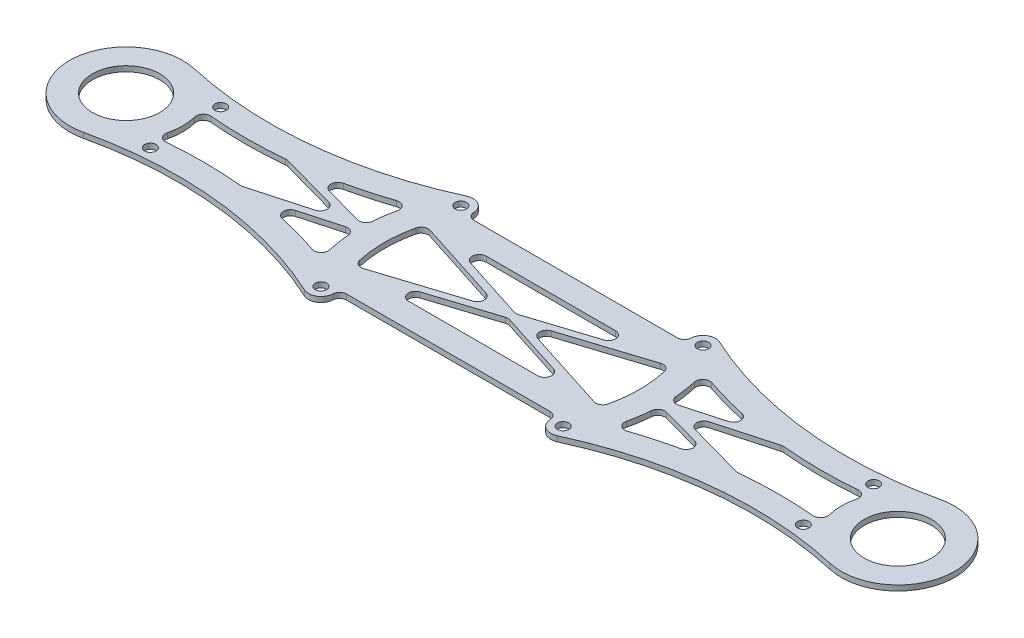
from build123d import *

# Parameters (mm, degrees)
SKETCH1_R                  = 3.5
BOSS_EXTRUDE1_DEPTH        = 0.75
F_3_2_3_2_DIAMETER_HOLE1_D = 3.2
SKETCH4_R                  = 9.5
CUT_EXTRUDE1_DEPTH         = 128.152713302
CUT_EXTRUDE4_DEPTH         = 128.152713302
FILLET1_R                  = 2


with BuildPart() as part:
    # Sketch1 → Boss-Extrude1 (new, symmetric)
    with BuildSketch(Plane(origin=(0, 0, 0), x_dir=(1, 0, 0), z_dir=(0, 1, 0))):
        with BuildLine():
            ThreePointArc((-37.239092363, -21.5), (-43, 0), (-37.239092363, 21.5))
            ThreePointArc((-37.239092363, 21.5), (-36.567343094, 22.335249783), (-35.674318722, 22.928037055))
            ThreePointArc((-35.674318722, 22.928037055), (-69.961373448, 13.496685886), (-105.45946442, 15.603352454))
            ThreePointArc((-105.45946442, 15.603352454), (-125, 0), (-105.45946442, -15.603352454))
            ThreePointArc((-105.45946442, -15.603352454), (-69.961373448, -13.496685886), (-35.674318722, -22.928037055))
            ThreePointArc((-35.674318722, -22.928037055), (-36.567343094, -22.335249783), (-37.239092363, -21.5))
        make_face()
        with BuildLine():
            ThreePointArc((-31.176914536, -18), (-36, 0), (-31.176914536, 18))
            ThreePointArc((-31.176914536, 18), (-35.958003449, 16.718911087), (-37.239092363, 21.5))
            ThreePointArc((-37.239092363, 21.5), (-43, 0), (-37.239092363, -21.5))
            ThreePointArc((-37.239092363, -21.5), (-35.958003449, -16.718911087), (-31.176914536, -18))
        make_face()
        with Locations((-34.208003449, -19.75)):
            Circle(SKETCH1_R)
        with Locations((-34.208003449, 19.75)):
            Circle(SKETCH1_R)
        with BuildLine():
            ThreePointArc((31.176914536, 18), (36, 0), (31.176914536, -18))
            Line((31.176914536, -18), (-31.176914536, -18))
            ThreePointArc((-31.176914536, -18), (-36, 0), (-31.176914536, 18))
            Line((-31.176914536, 18), (31.176914536, 18))
        make_face()
        with Locations((34.208003449, 19.75)):
            Circle(SKETCH1_R)
        with BuildLine():
            ThreePointArc((37.708003449, 19.75), (35.113870107, 16.369259608), (31.176914536, 18))
            ThreePointArc((31.176914536, 18), (36, 0), (31.176914536, -18))
            ThreePointArc((31.176914536, -18), (35.113870107, -16.369259608), (37.708003449, -19.75))
            ThreePointArc((37.708003449, -19.75), (37.588743841, -20.655866658), (37.239092363, -21.5))
            ThreePointArc((37.239092363, -21.5), (43, 0), (37.239092363, 21.5))
            ThreePointArc((37.239092363, 21.5), (37.588743841, 20.655866658), (37.708003449, 19.75))
        make_face()
        with Locations((34.208003449, -19.75)):
            Circle(SKETCH1_R)
        with BuildLine():
            ThreePointArc((105.45946442, 15.603352454), (69.961373448, 13.496685886), (35.674318722, 22.928037055))
            ThreePointArc((35.674318722, 22.928037055), (36.567343094, 22.335249783), (37.239092363, 21.5))
            ThreePointArc((37.239092363, 21.5), (43, 0), (37.239092363, -21.5))
            ThreePointArc((37.239092363, -21.5), (36.567343094, -22.335249783), (35.674318722, -22.928037055))
            ThreePointArc((35.674318722, -22.928037055), (69.961373448, -13.496685886), (105.45946442, -15.603352454))
            ThreePointArc((105.45946442, -15.603352454), (125, 0), (105.45946442, 15.603352454))
        make_face()
    extrude(amount=BOSS_EXTRUDE1_DEPTH, both=True)

    # Ø3.2 (3.2) Diameter Hole1 (through all)
    with Locations(Plane(origin=(0, 0.75, 0), x_dir=(1, 0, 0), z_dir=(0, 1, 0))):
        with Locations((-34.208003449, 19.75), (-34.208003449, -19.75), (34.208003449, -19.75), (34.208003449, 19.75), (-92.21668251, 9.928255337), (-92.21668251, -9.928255337), (92.21668251, 9.928255337), (92.21668251, -9.928255337)):
            Hole(F_3_2_3_2_DIAMETER_HOLE1_D / 2)

    # Sketch4 → Cut-Extrude1 (cut, through all)
    with BuildSketch(Plane(origin=(0, 0.75, 0), x_dir=(1, 0, 0), z_dir=(0, 1, 0))):
        with Locations(Location((-109, 0, 0), (0, 0, 270))):
            Circle(SKETCH4_R)
        with BuildLine():
            Line((-69.980899838, -6.458648161), (-46.735459102, 0))
            Line((-46.735459102, 0), (-69.980899838, 6.458648161))
            ThreePointArc((-69.980899838, 6.458648161), (-82.217649484, 5.904514504), (-94.444607799, 6.643836082))
            ThreePointArc((-94.444607799, 6.643836082), (-93, 0), (-94.444607799, -6.643836082))
            ThreePointArc((-94.444607799, -6.643836082), (-82.217649484, -5.904514504), (-69.980899838, -6.458648161))
        make_face()
        with BuildLine():
            Line((-64.779742297, 7.089291637), (-42.987555952, 1.03442411))
            ThreePointArc((-42.987555952, 1.03442411), (-42.397380289, 7.173712054), (-40.934970503, 13.165416435))
            ThreePointArc((-40.934970503, 13.165416435), (-52.695786799, 9.493300195), (-64.779742297, 7.089291637))
        make_face()
        with BuildLine():
            ThreePointArc((-40.934970503, -13.165416435), (-42.397380289, -7.173712054), (-42.987555952, -1.03442411))
            Line((-42.987555952, -1.03442411), (-64.779742297, -7.089291637))
            ThreePointArc((-64.779742297, -7.089291637), (-52.695786799, -9.493300195), (-40.934970503, -13.165416435))
        make_face()
        with BuildLine():
            Line((69.980899838, 6.458648161), (46.735459102, 0))
            Line((46.735459102, 0), (69.980899838, -6.458648161))
            ThreePointArc((69.980899838, -6.458648161), (82.217649484, -5.904514504), (94.444607799, -6.643836082))
            ThreePointArc((94.444607799, -6.643836082), (93, 0), (94.444607799, 6.643836082))
            ThreePointArc((94.444607799, 6.643836082), (82.217649484, 5.904514504), (69.980899838, 6.458648161))
        make_face()
        with BuildLine():
            ThreePointArc((40.934970503, 13.165416435), (42.397380289, 7.173712054), (42.987555952, 1.03442411))
            Line((42.987555952, 1.03442411), (64.779742297, 7.089291637))
            ThreePointArc((64.779742297, 7.089291637), (52.695786799, 9.493300195), (40.934970503, 13.165416435))
        make_face()
        with BuildLine():
            Line((64.779742297, -7.089291637), (42.987555952, -1.03442411))
            ThreePointArc((42.987555952, -1.03442411), (42.397380289, -7.173712054), (40.934970503, -13.165416435))
            ThreePointArc((40.934970503, -13.165416435), (52.695786799, -9.493300195), (64.779742297, -7.089291637))
        make_face()
        with Locations(Location((109, 0, 0), (0, 0, 270))):
            Circle(SKETCH4_R)
    extrude(amount=-CUT_EXTRUDE1_DEPTH, mode=Mode.SUBTRACT)

    # Sketch5 → Cut-Extrude4 (cut, through all)
    with BuildSketch(Plane(origin=(0, 0.75, 0), x_dir=(1, 0, 0), z_dir=(0, 1, 0))):
        with BuildLine():
            Line((-3.272727273, 0), (-34.570601363, 10.043581104))
            ThreePointArc((-34.570601363, 10.043581104), (-36, 0), (-34.570601363, -10.043581104))
            Line((-34.570601363, -10.043581104), (-3.272727273, 0))
        make_face()
        with BuildLine():
            Line((34.570601363, 10.043581104), (3.272727273, 0))
            Line((3.272727273, 0), (34.570601363, -10.043581104))
            ThreePointArc((34.570601363, -10.043581104), (36, 0), (34.570601363, 10.043581104))
        make_face()
        Polygon((31.005545729, 11), (-31.005545729, 11), (0, 1.050227939), align=None)
        Polygon((31.005545729, -11), (0, -1.050227939), (-31.005545729, -11), align=None)
    extrude(amount=-CUT_EXTRUDE4_DEPTH, mode=Mode.SUBTRACT)

    # Fillet1
    fillet1_edges = [part.edges().sort_by_distance(p)[0] for p in [
        (-69.980899838, 0, 6.458648161),
        (-94.444607799, 0, 6.643836082),
        (-94.444607799, 0, -6.643836082),
        (-69.980899838, 0, -6.458648161),
        (-46.735459102, 0, 0),
        (-64.779742297, 0, -7.089291637),
        (-40.934970503, 0, -13.165416435),
        (-42.987555952, 0, -1.03442411),
        (-40.934970503, 0, 13.165416435),
        (-64.779742297, 0, 7.089291637),
        (-42.987555952, 0, 1.03442411),
        (94.444607799, 0, -6.643836082),
        (94.444607799, 0, 6.643836082),
        (69.980899838, 0, 6.458648161),
        (46.735459102, 0, 0),
        (69.980899838, 0, -6.458648161),
        (40.934970503, 0, -13.165416435),
        (64.779742297, 0, -7.089291637),
        (42.987555952, 0, -1.03442411),
        (42.987555952, 0, 1.03442411),
        (64.779742297, 0, 7.089291637),
        (40.934970503, 0, 13.165416435),
        (-34.570601363, 0, -10.043581104),
        (-3.272727273, 0, 0),
        (-34.570601363, 0, 10.043581104),
        (31.176914536, 0, 18),
        (-31.176914536, 0, 18),
        (34.570601363, 0, 10.043581104),
        (3.272727273, 0, 0),
        (-31.176914536, 0, -18),
        (34.570601363, 0, -10.043581104),
        (31.176914536, 0, -18),
        (0, 0, -1.050227939),
        (-31.005545729, 0, -11),
        (31.005545729, 0, -11),
        (-31.005545729, 0, 11),
        (0, 0, 1.050227939),
        (31.005545729, 0, 11),
    ]]
    fillet(fillet1_edges, radius=FILLET1_R)


solid = part.part
